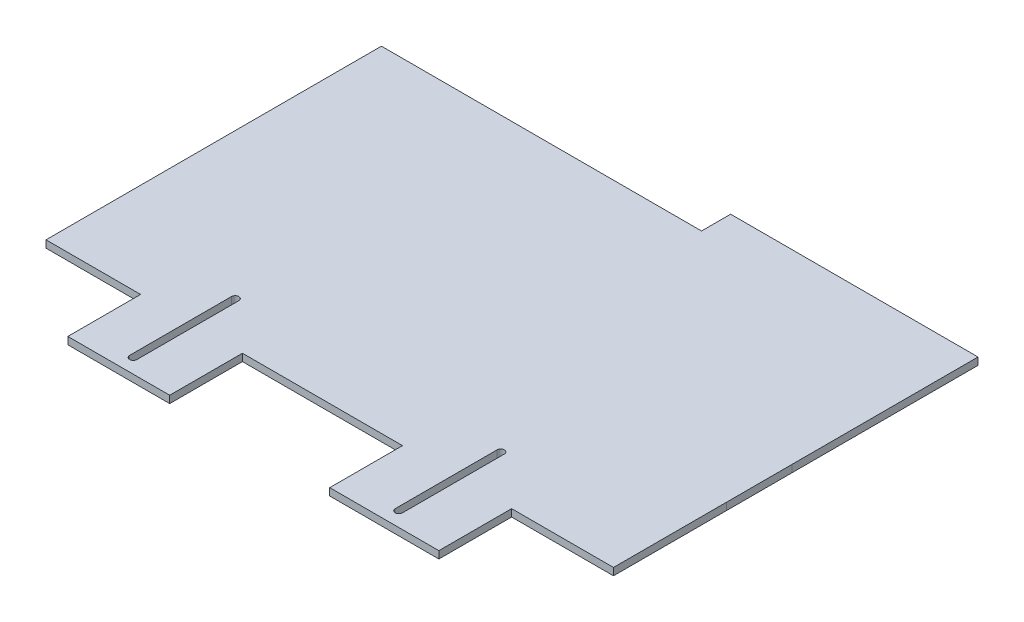
from build123d import *

# Parameters (mm, degrees)
SKETCH1_W           = 495.3
SKETCH1_H           = 57.15
BOSS_EXTRUDE1_DEPTH = 3.175
SKETCH23_W          = 495.3
SKETCH23_H          = 381.64999997
BOSS_EXTRUDE3_DEPTH = 3.175
SKETCH24_W          = 88.9
SKETCH24_H          = 63.5
SKETCH24_W_2        = 139.7
SKETCH24_W_3        = 82.55
CUT_EXTRUDE6_DEPTH  = 6.35
CUT_EXTRUDE7_DEPTH  = 6.35
SKETCH27_W          = 279.4
SKETCH27_H          = 25.4
CUT_EXTRUDE8_DEPTH  = 6.35


with BuildPart() as part:
    # Sketch1 → Boss-Extrude1 (new, symmetric)
    with BuildSketch(Plane(origin=(0, 0, 0), x_dir=(1, 0, 0), z_dir=(0, 1, 0))):
        Rectangle(SKETCH1_W, SKETCH1_H)
    extrude(amount=BOSS_EXTRUDE1_DEPTH, both=True)

    # Sketch23 → Boss-Extrude3 (add, symmetric)
    with BuildSketch(Plane(origin=(0, 0, 0), x_dir=(1, 0, 0), z_dir=(0, 1, 0))):
        with Locations((-0.01297497, 0)):
            Rectangle(SKETCH23_W, SKETCH23_H)
    extrude(amount=BOSS_EXTRUDE3_DEPTH, both=True)

    # Sketch24 → Cut-Extrude6 (cut)
    with BuildSketch(Plane(origin=(0, 3.175, 0), x_dir=(1, 0, 0), z_dir=(0, 1, 0))):
        with Locations((203.18702503, -159.074999985)):
            Rectangle(SKETCH24_W, SKETCH24_H)
        with Locations((-6.36297497, -159.074999985)):
            Rectangle(SKETCH24_W_2, SKETCH24_H)
        with Locations((-206.38797497, -159.074999985)):
            Rectangle(SKETCH24_W_3, SKETCH24_H)
    extrude(amount=-CUT_EXTRUDE6_DEPTH, mode=Mode.SUBTRACT)

    # Sketch25 → Cut-Extrude7 (cut)
    with BuildSketch(Plane(origin=(0, 3.175, 0), x_dir=(1, 0, 0), z_dir=(0, 1, 0))):
        with BuildLine():
            Line((114.28702503, -89.224999985), (114.28702503, -178.124999985))
            ThreePointArc((114.28702503, -178.124999985), (111.11202503, -181.299999985), (107.93702503, -178.124999985))
            Line((107.93702503, -178.124999985), (107.93702503, -89.224999985))
            ThreePointArc((107.93702503, -89.224999985), (111.11202503, -86.049999985), (114.28702503, -89.224999985))
        make_face()
        with BuildLine():
            Line((-117.48797497, -89.224999985), (-117.48797497, -178.124999985))
            ThreePointArc((-117.48797497, -178.124999985), (-120.66297497, -181.299999985), (-123.83797497, -178.124999985))
            Line((-123.83797497, -178.124999985), (-123.83797497, -89.224999985))
            ThreePointArc((-123.83797497, -89.224999985), (-120.66297497, -86.049999985), (-117.48797497, -89.224999985))
        make_face()
    extrude(amount=-CUT_EXTRUDE7_DEPTH, mode=Mode.SUBTRACT)

    # Sketch27 → Cut-Extrude8 (cut)
    with BuildSketch(Plane(origin=(0, 3.175, 0), x_dir=(1, 0, 0), z_dir=(0, 1, 0))):
        with Locations((-107.96297497, 178.124999985)):
            Rectangle(SKETCH27_W, SKETCH27_H)
    extrude(amount=-CUT_EXTRUDE8_DEPTH, mode=Mode.SUBTRACT)


solid = part.part
